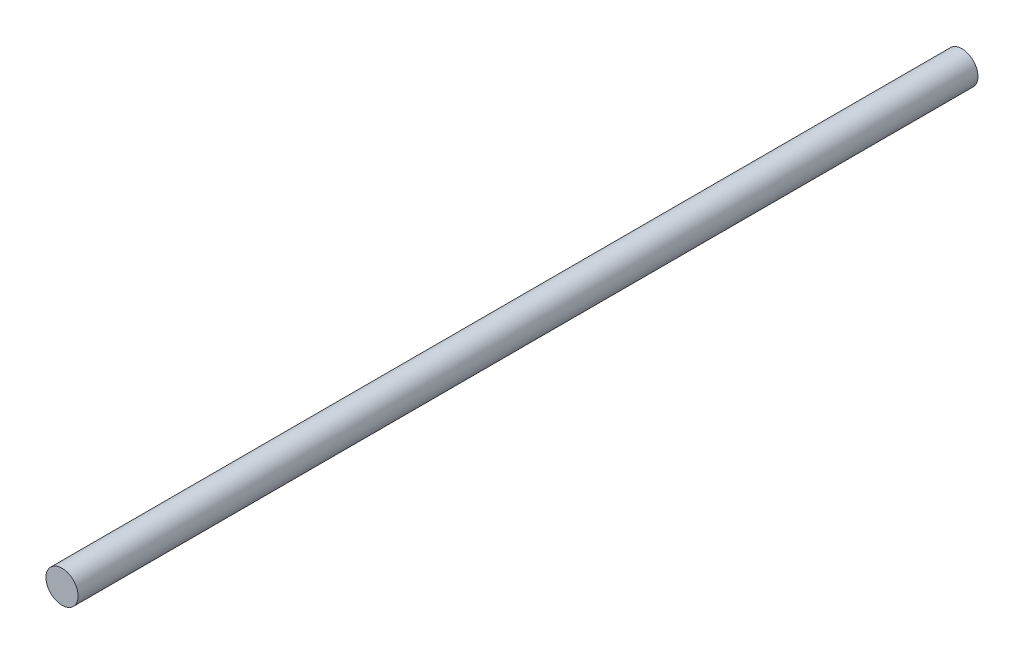
from build123d import *

# Parameters (mm, degrees)
EXTRUDE_START   = -150
SKETCH_10_R     = 5
EXTRUDE_1_DEPTH = 280


with BuildPart() as part:
    # 草图10 → 凸台-拉伸1 (new body)
    with BuildSketch(Plane.XY.offset(EXTRUDE_START)):
        Circle(SKETCH_10_R)
    extrude(amount=EXTRUDE_1_DEPTH)


solid = part.part
